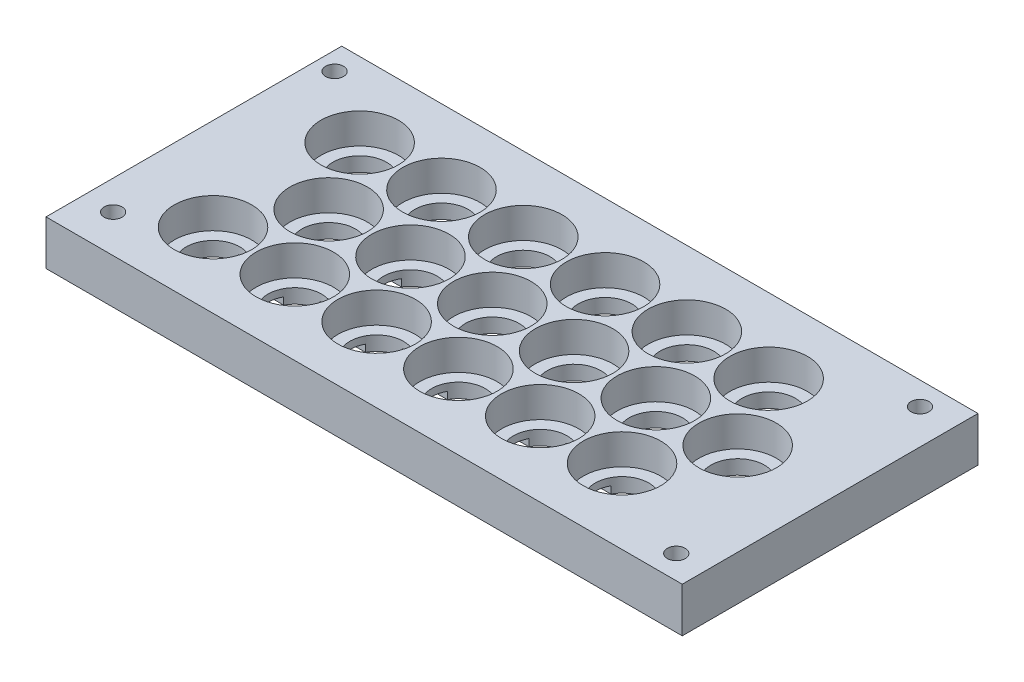
from build123d import *

# Parameters (mm, degrees)
SKETCH1_W           = 177.725
SKETCH1_H           = 82.6130016
SKETCH1_R           = 2.5
SKETCH1_R_2         = 10.825
BOSS_EXTRUDE1_DEPTH = 12.5
SKETCH1_3_R         = 10.825
SKETCH1_3_R_2       = 7.5
BOSS_EXTRUDE2_DEPTH = 4
CUT_EXTRUDE2_DEPTH  = 2


with BuildPart() as part:
    # Sketch1 → Boss-Extrude1 (new body)
    with BuildSketch(Plane(origin=(0, 0, 0), x_dir=(1, 0, 0), z_dir=(0, 1, 0))):
        with Locations((51.2125, 0)):
            Rectangle(SKETCH1_W, SKETCH1_H)
        with Locations((-29.443209777, -30.772056418)):
            Circle(SKETCH1_R, mode=Mode.SUBTRACT)
        with Locations((-11.825, -20.4815008)):
            Circle(SKETCH1_R_2, mode=Mode.SUBTRACT)
        with Locations((11.025, -20.4815008)):
            Circle(SKETCH1_R_2, mode=Mode.SUBTRACT)
        with Locations((33.875, -20.4815008)):
            Circle(SKETCH1_R_2, mode=Mode.SUBTRACT)
        with Locations((131.797016059, -34.696609752)):
            Circle(SKETCH1_R, mode=Mode.SUBTRACT)
        with Locations((56.725, -20.4815008)):
            Circle(SKETCH1_R_2, mode=Mode.SUBTRACT)
        with Locations((79.575, -20.4815008)):
            Circle(SKETCH1_R_2, mode=Mode.SUBTRACT)
        with Locations((102.425, -20.4815008)):
            Circle(SKETCH1_R_2, mode=Mode.SUBTRACT)
        Circle(SKETCH1_R_2, mode=Mode.SUBTRACT)
        with Locations((-11.825, 20.4815008)):
            Circle(SKETCH1_R_2, mode=Mode.SUBTRACT)
        with Locations((22.85, 0)):
            Circle(SKETCH1_R_2, mode=Mode.SUBTRACT)
        with Locations((45.7, 0)):
            Circle(SKETCH1_R_2, mode=Mode.SUBTRACT)
        with Locations((11.025, 20.4815008)):
            Circle(SKETCH1_R_2, mode=Mode.SUBTRACT)
        with Locations((33.875, 20.4815008)):
            Circle(SKETCH1_R_2, mode=Mode.SUBTRACT)
        with Locations((-32.544821209, 34.192456987)):
            Circle(SKETCH1_R, mode=Mode.SUBTRACT)
        with Locations((68.55, 0)):
            Circle(SKETCH1_R_2, mode=Mode.SUBTRACT)
        with Locations((91.4, 0)):
            Circle(SKETCH1_R_2, mode=Mode.SUBTRACT)
        with Locations((56.725, 20.4815008)):
            Circle(SKETCH1_R_2, mode=Mode.SUBTRACT)
        with Locations((79.575, 20.4815008)):
            Circle(SKETCH1_R_2, mode=Mode.SUBTRACT)
        with Locations((114.25, 0)):
            Circle(SKETCH1_R_2, mode=Mode.SUBTRACT)
        with Locations((102.425, 20.4815008)):
            Circle(SKETCH1_R_2, mode=Mode.SUBTRACT)
        with Locations((130.319770801, 34.847551633)):
            Circle(SKETCH1_R, mode=Mode.SUBTRACT)
    extrude(amount=BOSS_EXTRUDE1_DEPTH)

    # Sketch1<3> → Boss-Extrude2 (add)
    # profile 1 of 18: a face of its own
    with BuildSketch(Plane(origin=(0, 0, 0), x_dir=(1, 0, 0), z_dir=(0, 1, 0))):
        with Locations((-11.825, 20.4815008)):
            Circle(SKETCH1_3_R)
        with Locations((-11.825, 20.4815008)):
            Circle(SKETCH1_3_R_2, mode=Mode.SUBTRACT)
    # profile 2 of 18: a face of its own
    with BuildSketch(Plane(origin=(0, 0, 0), x_dir=(1, 0, 0), z_dir=(0, 1, 0))):
        Circle(SKETCH1_3_R)
        Circle(SKETCH1_3_R_2, mode=Mode.SUBTRACT)
    # profile 3 of 18: a face of its own
    with BuildSketch(Plane(origin=(0, 0, 0), x_dir=(1, 0, 0), z_dir=(0, 1, 0))):
        with Locations((-11.825, -20.4815008)):
            Circle(SKETCH1_3_R)
        with Locations((-11.825, -20.4815008)):
            Circle(SKETCH1_3_R_2, mode=Mode.SUBTRACT)
    # profile 4 of 18: a face of its own
    with BuildSketch(Plane(origin=(0, 0, 0), x_dir=(1, 0, 0), z_dir=(0, 1, 0))):
        with Locations((11.025, 20.4815008)):
            Circle(SKETCH1_3_R)
        with Locations((11.025, 20.4815008)):
            Circle(SKETCH1_3_R_2, mode=Mode.SUBTRACT)
    # profile 5 of 18: a face of its own
    with BuildSketch(Plane(origin=(0, 0, 0), x_dir=(1, 0, 0), z_dir=(0, 1, 0))):
        with Locations((22.85, 0)):
            Circle(SKETCH1_3_R)
        with Locations((22.85, 0)):
            Circle(SKETCH1_3_R_2, mode=Mode.SUBTRACT)
    # profile 6 of 18: a face of its own
    with BuildSketch(Plane(origin=(0, 0, 0), x_dir=(1, 0, 0), z_dir=(0, 1, 0))):
        with Locations((11.025, -20.4815008)):
            Circle(SKETCH1_3_R)
        with Locations((11.025, -20.4815008)):
            Circle(SKETCH1_3_R_2, mode=Mode.SUBTRACT)
    # profile 7 of 18: a face of its own
    with BuildSketch(Plane(origin=(0, 0, 0), x_dir=(1, 0, 0), z_dir=(0, 1, 0))):
        with Locations((33.875, 20.4815008)):
            Circle(SKETCH1_3_R)
        with Locations((33.875, 20.4815008)):
            Circle(SKETCH1_3_R_2, mode=Mode.SUBTRACT)
    # profile 8 of 18: a face of its own
    with BuildSketch(Plane(origin=(0, 0, 0), x_dir=(1, 0, 0), z_dir=(0, 1, 0))):
        with Locations((45.7, 0)):
            Circle(SKETCH1_3_R)
        with Locations((45.7, 0)):
            Circle(SKETCH1_3_R_2, mode=Mode.SUBTRACT)
    # profile 9 of 18: a face of its own
    with BuildSketch(Plane(origin=(0, 0, 0), x_dir=(1, 0, 0), z_dir=(0, 1, 0))):
        with Locations((33.875, -20.4815008)):
            Circle(SKETCH1_3_R)
        with Locations((33.875, -20.4815008)):
            Circle(SKETCH1_3_R_2, mode=Mode.SUBTRACT)
    # profile 10 of 18: a face of its own
    with BuildSketch(Plane(origin=(0, 0, 0), x_dir=(1, 0, 0), z_dir=(0, 1, 0))):
        with Locations((56.725, 20.4815008)):
            Circle(SKETCH1_3_R)
        with Locations((56.725, 20.4815008)):
            Circle(SKETCH1_3_R_2, mode=Mode.SUBTRACT)
    # profile 11 of 18: a face of its own
    with BuildSketch(Plane(origin=(0, 0, 0), x_dir=(1, 0, 0), z_dir=(0, 1, 0))):
        with Locations((68.55, 0)):
            Circle(SKETCH1_3_R)
        with Locations((68.55, 0)):
            Circle(SKETCH1_3_R_2, mode=Mode.SUBTRACT)
    # profile 12 of 18: a face of its own
    with BuildSketch(Plane(origin=(0, 0, 0), x_dir=(1, 0, 0), z_dir=(0, 1, 0))):
        with Locations((56.725, -20.4815008)):
            Circle(SKETCH1_3_R)
        with Locations((56.725, -20.4815008)):
            Circle(SKETCH1_3_R_2, mode=Mode.SUBTRACT)
    # profile 13 of 18: a face of its own
    with BuildSketch(Plane(origin=(0, 0, 0), x_dir=(1, 0, 0), z_dir=(0, 1, 0))):
        with Locations((79.575, 20.4815008)):
            Circle(SKETCH1_3_R)
        with Locations((79.575, 20.4815008)):
            Circle(SKETCH1_3_R_2, mode=Mode.SUBTRACT)
    # profile 14 of 18: a face of its own
    with BuildSketch(Plane(origin=(0, 0, 0), x_dir=(1, 0, 0), z_dir=(0, 1, 0))):
        with Locations((91.4, 0)):
            Circle(SKETCH1_3_R)
        with Locations((91.4, 0)):
            Circle(SKETCH1_3_R_2, mode=Mode.SUBTRACT)
    # profile 15 of 18: a face of its own
    with BuildSketch(Plane(origin=(0, 0, 0), x_dir=(1, 0, 0), z_dir=(0, 1, 0))):
        with Locations((79.575, -20.4815008)):
            Circle(SKETCH1_3_R)
        with Locations((79.575, -20.4815008)):
            Circle(SKETCH1_3_R_2, mode=Mode.SUBTRACT)
    # profile 16 of 18: a face of its own
    with BuildSketch(Plane(origin=(0, 0, 0), x_dir=(1, 0, 0), z_dir=(0, 1, 0))):
        with Locations((102.425, 20.4815008)):
            Circle(SKETCH1_3_R)
        with Locations((102.425, 20.4815008)):
            Circle(SKETCH1_3_R_2, mode=Mode.SUBTRACT)
    # profile 17 of 18: a face of its own
    with BuildSketch(Plane(origin=(0, 0, 0), x_dir=(1, 0, 0), z_dir=(0, 1, 0))):
        with Locations((114.25, 0)):
            Circle(SKETCH1_3_R)
        with Locations((114.25, 0)):
            Circle(SKETCH1_3_R_2, mode=Mode.SUBTRACT)
    # profile 18 of 18: a face of its own
    with BuildSketch(Plane(origin=(0, 0, 0), x_dir=(1, 0, 0), z_dir=(0, 1, 0))):
        with Locations((102.425, -20.4815008)):
            Circle(SKETCH1_3_R)
        with Locations((102.425, -20.4815008)):
            Circle(SKETCH1_3_R_2, mode=Mode.SUBTRACT)
    extrude(amount=BOSS_EXTRUDE2_DEPTH)

    # Sketch3 → Cut-Extrude2 (cut)
    with BuildSketch(Plane.XZ):
        with BuildLine():
            Line((-5.191750419, 23.9815008), (4.391750419, 23.9815008))
            ThreePointArc((4.391750419, 23.9815008), (3.525002711, 20.475123984), (4.397711702, 16.970226128))
            Line((4.397711702, 16.970226128), (-5.197711702, 16.970226128))
            ThreePointArc((-5.197711702, 16.970226128), (-4.325002711, 20.475123984), (-5.191750419, 23.9815008))
        make_face()
        with BuildLine():
            Line((6.818358092, 3.124098739), (16.031641908, 3.124098739))
            ThreePointArc((16.031641908, 3.124098739), (15.362063286, -0.425210269), (16.429144184, -3.875901261))
            Line((16.429144184, -3.875901261), (6.420855816, -3.875901261))
            ThreePointArc((6.420855816, -3.875901261), (7.487936714, -0.425210269), (6.818358092, 3.124098739))
        make_face()
        with BuildLine():
            Line((-5.225216684, 16.918796746), (0.400216684, 7.489314161))
            ThreePointArc((0.400216684, 7.489314161), (-3.669226532, 6.541160192), (-6.599783316, 3.562704054))
            Line((-6.599783316, 3.562704054), (-12.225216684, 12.992186638))
            ThreePointArc((-12.225216684, 12.992186638), (-8.155773468, 13.940340608), (-5.225216684, 16.918796746))
        make_face()
        with BuildLine():
            Line((27.247711702, 16.970226128), (17.652288298, 16.970226128))
            ThreePointArc((17.652288298, 16.970226128), (18.524997289, 20.475123984), (17.658249581, 23.9815008))
            Line((17.658249581, 23.9815008), (27.241750419, 23.9815008))
            ThreePointArc((27.241750419, 23.9815008), (26.375002711, 20.475123984), (27.247711702, 16.970226128))
        make_face()
        with BuildLine():
            Line((10.624783316, 12.992186638), (16.250216684, 3.562704054))
            ThreePointArc((16.250216684, 3.562704054), (19.180773468, 6.541160192), (23.250216684, 7.489314161))
            Line((23.250216684, 7.489314161), (17.624783316, 16.918796746))
            ThreePointArc((17.624783316, 16.918796746), (14.694226532, 13.940340608), (10.624783316, 12.992186638))
        make_face()
        with BuildLine():
            Line((50.097711702, 16.970226128), (40.502288298, 16.970226128))
            ThreePointArc((40.502288298, 16.970226128), (41.374997289, 20.475123984), (40.508249581, 23.9815008))
            Line((40.508249581, 23.9815008), (50.091750419, 23.9815008))
            ThreePointArc((50.091750419, 23.9815008), (49.225002711, 20.475123984), (50.097711702, 16.970226128))
        make_face()
        with BuildLine():
            Line((33.474783316, 12.992186638), (39.100216684, 3.562704054))
            ThreePointArc((39.100216684, 3.562704054), (42.030773468, 6.541160192), (46.100216684, 7.489314161))
            Line((46.100216684, 7.489314161), (40.474783316, 16.918796746))
            ThreePointArc((40.474783316, 16.918796746), (37.544226532, 13.940340608), (33.474783316, 12.992186638))
        make_face()
        with BuildLine():
            Line((72.947711702, 16.970226128), (63.352288298, 16.970226128))
            ThreePointArc((63.352288298, 16.970226128), (64.224997289, 20.475123984), (63.358249581, 23.9815008))
            Line((63.358249581, 23.9815008), (72.941750419, 23.9815008))
            ThreePointArc((72.941750419, 23.9815008), (72.075002711, 20.475123984), (72.947711702, 16.970226128))
        make_face()
        with BuildLine():
            Line((56.324783316, 12.992186638), (61.950216684, 3.562704054))
            ThreePointArc((61.950216684, 3.562704054), (64.880773468, 6.541160192), (68.950216684, 7.489314161))
            Line((68.950216684, 7.489314161), (63.324783316, 16.918796746))
            ThreePointArc((63.324783316, 16.918796746), (60.394226532, 13.940340608), (56.324783316, 12.992186638))
        make_face()
        with BuildLine():
            Line((95.797711702, 16.970226128), (86.202288298, 16.970226128))
            ThreePointArc((86.202288298, 16.970226128), (87.074997289, 20.475123984), (86.208249581, 23.9815008))
            Line((86.208249581, 23.9815008), (95.791750419, 23.9815008))
            ThreePointArc((95.791750419, 23.9815008), (94.925002711, 20.475123984), (95.797711702, 16.970226128))
        make_face()
        with BuildLine():
            Line((79.174783316, 12.992186638), (84.800216684, 3.562704054))
            ThreePointArc((84.800216684, 3.562704054), (87.730773468, 6.541160192), (91.800216684, 7.489314161))
            Line((91.800216684, 7.489314161), (86.174783316, 16.918796746))
            ThreePointArc((86.174783316, 16.918796746), (83.244226532, 13.940340608), (79.174783316, 12.992186638))
        make_face()
    extrude(amount=-CUT_EXTRUDE2_DEPTH, mode=Mode.SUBTRACT)


solid = part.part
